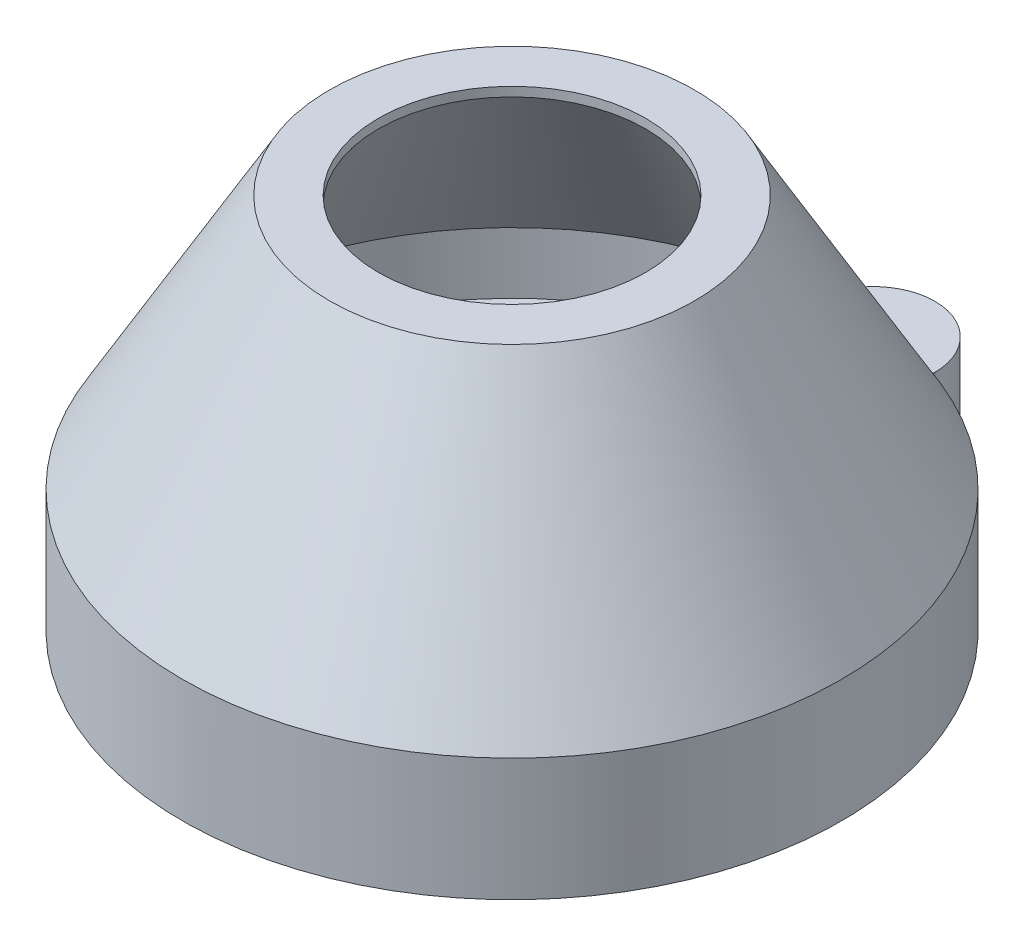
from build123d import *

# Parameters (mm, degrees)
SKETCH3_R           = 26.878
SKETCH3_R_2         = 26.128
BOSS_EXTRUDE1_DEPTH = 10
SKETCH5_R           = 1.5
BOSS_EXTRUDE4_DEPTH = 5.5
CUT_EXTRUDE1_DEPTH  = 3.5
BOSS_EXTRUDE5_START = -3.5
SKETCH8_R           = 26.128
SKETCH8_R_2         = 25.5
BOSS_EXTRUDE5_DEPTH = 1.5


with BuildPart() as part:
    # Sketch3 → Boss-Extrude1 (new body)
    with BuildSketch(Plane(origin=(0, 0, 0), x_dir=(1, 0, 0), z_dir=(0, 1, 0))):
        with Locations(Location((0, 0, 0), (0, 0, 270))):
            Circle(SKETCH3_R)
        with Locations(Location((0, 0, 0), (0, 0, 270))):
            Circle(SKETCH3_R_2, mode=Mode.SUBTRACT)
    extrude(amount=BOSS_EXTRUDE1_DEPTH)

    # Sketch5 → Boss-Extrude4 (add)
    with BuildSketch(Plane.XZ):
        with BuildLine():
            Line((-5.543162198, -29.995394675), (-5.543162198, -26.300194616))
            ThreePointArc((-5.543162198, -26.300194616), (-0.534858171, -26.863033142), (4.491880525, -26.499997988))
            Line((4.491880525, -26.499997988), (4.491880525, -29.995394675))
            ThreePointArc((4.491880525, -29.995394675), (-0.525640836, -35.012916036), (-5.543162198, -29.995394675))
        make_face()
        with Locations(Location((-0.525640836, -29.995394675, 0), (0, 0, 270))):
            Circle(SKETCH5_R, mode=Mode.SUBTRACT)
    extrude(amount=-BOSS_EXTRUDE4_DEPTH)

    # Sketch6 → Cut-Extrude1 (cut)
    with BuildSketch(Plane(origin=(0, 0, 0), x_dir=(-1, 0, 0), z_dir=(0, -1, 0))):
        with BuildLine():
            Line((4.710133197, 29.995394675), (4.710133197, 25.699942204))
            ThreePointArc((4.710133197, 25.699942204), (0.530383369, 26.096098926), (-3.658851524, 25.81760336))
            Line((-3.658851524, 25.81760336), (-3.658851524, 29.995394675))
            ThreePointArc((-3.658851524, 29.995394675), (0.525640836, 34.179887036), (4.710133197, 29.995394675))
        make_face()
    extrude(amount=-CUT_EXTRUDE1_DEPTH, mode=Mode.SUBTRACT)

    # Sketch7 → Revolve1 (revolve)
    with BuildSketch(Plane.XY, mode=Mode.PRIVATE) as revolve1_sk:
        Polygon((-26.878, 10), (-14.897981914, 30.75), (-10.897981914, 30.75), (-10.897981914, 30), (-14.580994616, 30), (-26.128, 10), align=None)
    revolve(revolve1_sk.sketch.rotate(Axis((0, 30.1875, 0), (0, -1, 0)), 270), axis=Axis((0, 30.1875, 0), (0, -1, 0)))

    # Sketch8 → Boss-Extrude5 (add)
    with BuildSketch(Plane.XZ.offset(BOSS_EXTRUDE5_START)):
        with Locations(Location((0, 0, 0), (0, 0, 270))):
            Circle(SKETCH8_R)
        with Locations(Location((0, 0, 0), (0, 0, 270))):
            Circle(SKETCH8_R_2, mode=Mode.SUBTRACT)
    extrude(amount=-BOSS_EXTRUDE5_DEPTH)


solid = part.part
